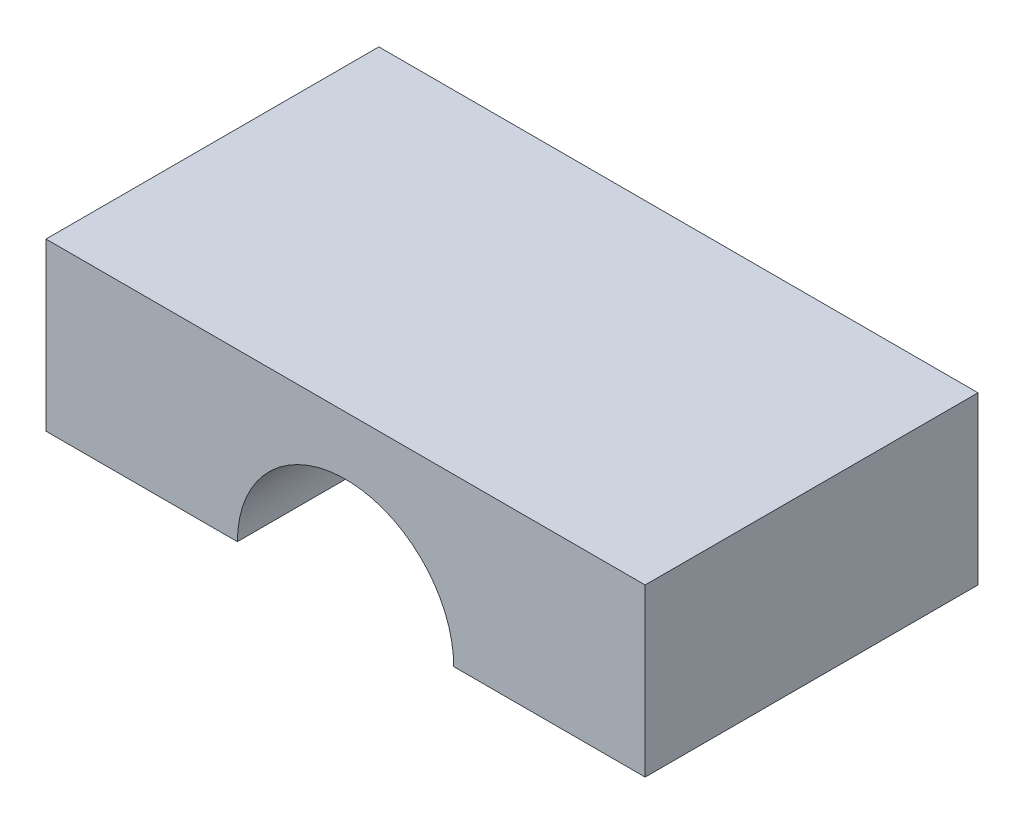
from build123d import *

# Parameters (mm, degrees)
BOSS_EXTRUDE1_DEPTH = 10


with BuildPart() as part:
    # Sketch1 → Boss-Extrude1 (new body)
    with BuildSketch(Plane.XY):
        with BuildLine():
            Line((3.25, 0), (9, 0))
            Line((9, 0), (9, 5))
            Line((9, 5), (-9, 5))
            Line((-9, 5), (-9, 0))
            Line((-9, 0), (-3.25, 0))
            ThreePointArc((-3.25, 0), (0, 3.25), (3.25, 0))
        make_face()
    extrude(amount=BOSS_EXTRUDE1_DEPTH)


solid = part.part
